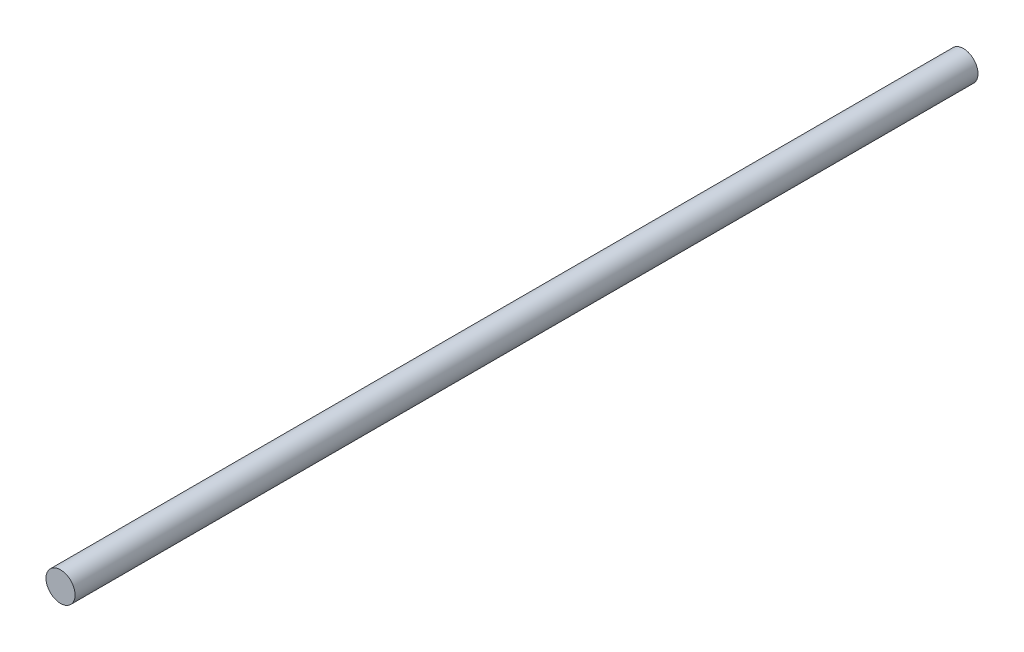
from build123d import *

# Parameters (mm, degrees)
ESQUISSE2_R        = 5
BOSS_EXTRU_3_DEPTH = 310


with BuildPart() as part:
    # Esquisse2 → Boss.-Extru.3 (new body)
    with BuildSketch(Plane.XY):
        Circle(ESQUISSE2_R)
    extrude(amount=BOSS_EXTRU_3_DEPTH)


solid = part.part
